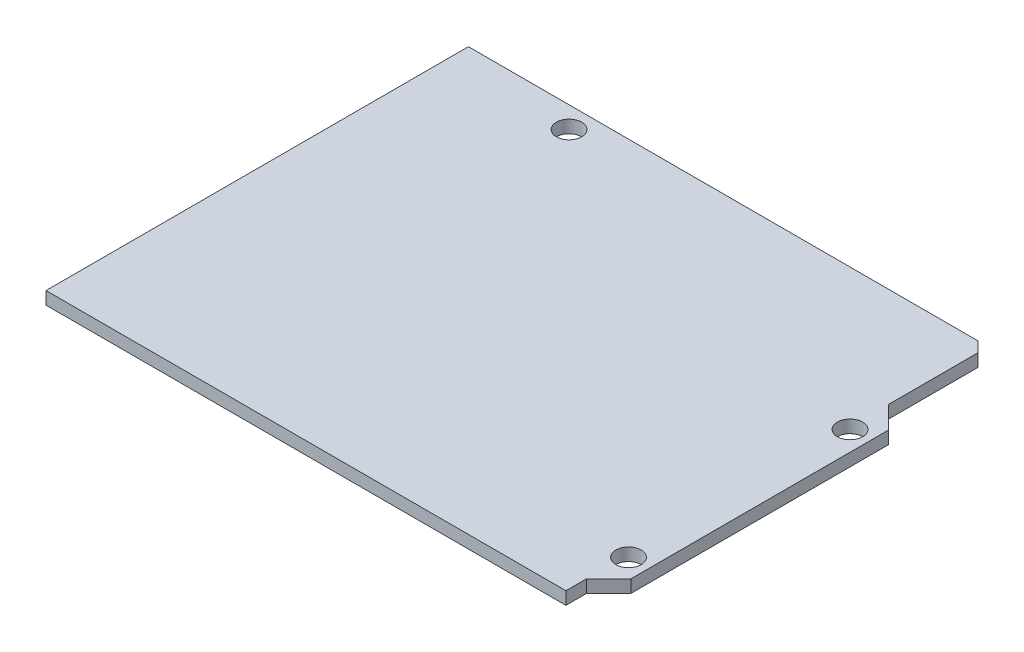
from build123d import *

# Parameters (mm, degrees)
SKETCH1_R           = 1.6
BOSS_EXTRUDE1_DEPTH = 1.6


with BuildPart() as part:
    # Sketch1 → Boss-Extrude1 (new body)
    with BuildSketch(Plane(origin=(0, 0, 0), x_dir=(1, 0, 0), z_dir=(0, 1, 0))):
        Polygon((65.6, 0), (65.6, 2.6), (68.4, 5.4), (68.4, 37.9), (65.6, 40.7), (65.6, 52), (64.3, 53.3), (0, 53.3), (0, 0), align=None)
        with Locations(Location((65.9, 7.6, 0), (0, 0, 270))):
            Circle(SKETCH1_R, mode=Mode.SUBTRACT)
        with Locations(Location((65.9, 35.55, 0), (0, 0, 270))):
            Circle(SKETCH1_R, mode=Mode.SUBTRACT)
        with Locations(Location((15.4, 50.6, 0), (0, 0, 270))):
            Circle(SKETCH1_R, mode=Mode.SUBTRACT)
    extrude(amount=BOSS_EXTRUDE1_DEPTH)


solid = part.part
